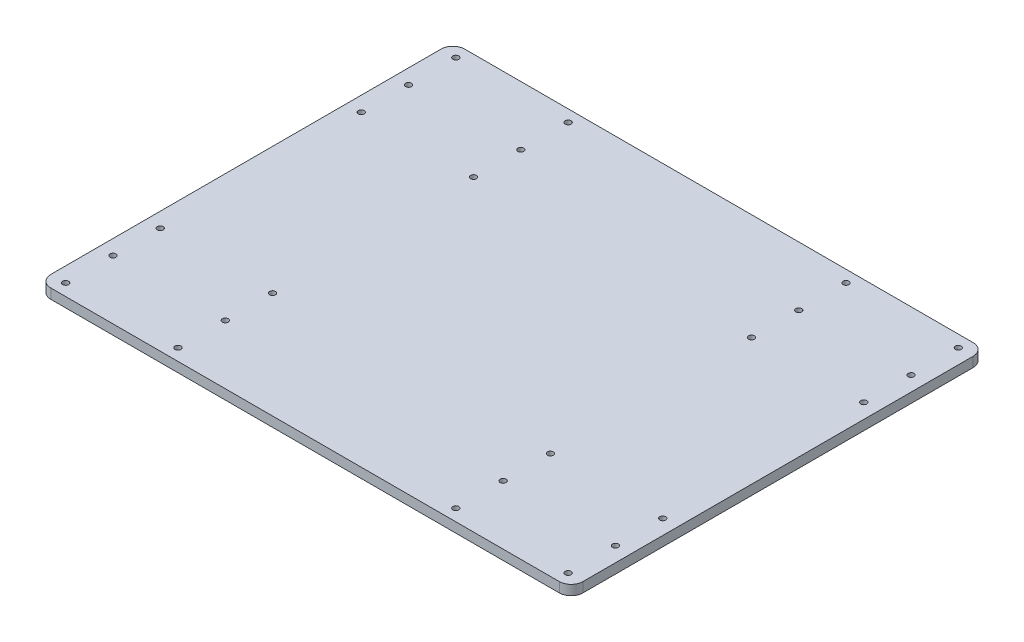
from build123d import *

# Parameters (mm, degrees)
SKETCH1_R           = 1.5
BOSS_EXTRUDE1_DEPTH = 5


with BuildPart() as part:
    # Sketch1 → Boss-Extrude1 (new body)
    with BuildSketch(Plane(origin=(0, 0, 0), x_dir=(1, 0, 0), z_dir=(0, 1, 0))):
        with BuildLine():
            Line((-129, -105), (129, -105))
            ThreePointArc((129, -105), (133.242640687, -103.242640687), (135, -99))
            Line((135, -99), (135, 99))
            ThreePointArc((135, 99), (133.242640687, 103.242640687), (129, 105))
            Line((129, 105), (-129, 105))
            ThreePointArc((-129, 105), (-133.242640687, 103.242640687), (-135, 99))
            Line((-135, 99), (-135, -99))
            ThreePointArc((-135, -99), (-133.242640687, -103.242640687), (-129, -105))
        make_face()
        with Locations(Location((-127.5, 99, 0), (0, 0, 270))):
            Circle(SKETCH1_R, mode=Mode.SUBTRACT)
        with Locations(Location((-127.5, 75, 0), (0, 0, 270))):
            Circle(SKETCH1_R, mode=Mode.SUBTRACT)
        with Locations(Location((-127.5, 51, 0), (0, 0, 270))):
            Circle(SKETCH1_R, mode=Mode.SUBTRACT)
        with Locations(Location((-70.5, 99, 0), (0, 0, 270))):
            Circle(SKETCH1_R, mode=Mode.SUBTRACT)
        with Locations(Location((-70.5, 75, 0), (0, 0, 270))):
            Circle(SKETCH1_R, mode=Mode.SUBTRACT)
        with Locations(Location((-70.5, 51, 0), (0, 0, 270))):
            Circle(SKETCH1_R, mode=Mode.SUBTRACT)
        with Locations(Location((70.5, 51, 0), (0, 0, 90))):
            Circle(SKETCH1_R, mode=Mode.SUBTRACT)
        with Locations(Location((70.5, 75, 0), (0, 0, 90))):
            Circle(SKETCH1_R, mode=Mode.SUBTRACT)
        with Locations(Location((70.5, 99, 0), (0, 0, 90))):
            Circle(SKETCH1_R, mode=Mode.SUBTRACT)
        with Locations(Location((127.5, 51, 0), (0, 0, 90))):
            Circle(SKETCH1_R, mode=Mode.SUBTRACT)
        with Locations(Location((127.5, 75, 0), (0, 0, 90))):
            Circle(SKETCH1_R, mode=Mode.SUBTRACT)
        with Locations(Location((127.5, 99, 0), (0, 0, 90))):
            Circle(SKETCH1_R, mode=Mode.SUBTRACT)
        with Locations(Location((127.5, -99, 0), (0, 0, 270))):
            Circle(SKETCH1_R, mode=Mode.SUBTRACT)
        with Locations(Location((127.5, -75, 0), (0, 0, 270))):
            Circle(SKETCH1_R, mode=Mode.SUBTRACT)
        with Locations(Location((127.5, -51, 0), (0, 0, 270))):
            Circle(SKETCH1_R, mode=Mode.SUBTRACT)
        with Locations(Location((70.5, -99, 0), (0, 0, 270))):
            Circle(SKETCH1_R, mode=Mode.SUBTRACT)
        with Locations(Location((70.5, -75, 0), (0, 0, 270))):
            Circle(SKETCH1_R, mode=Mode.SUBTRACT)
        with Locations(Location((70.5, -51, 0), (0, 0, 270))):
            Circle(SKETCH1_R, mode=Mode.SUBTRACT)
        with Locations(Location((-70.5, -51, 0), (0, 0, 90))):
            Circle(SKETCH1_R, mode=Mode.SUBTRACT)
        with Locations(Location((-70.5, -75, 0), (0, 0, 90))):
            Circle(SKETCH1_R, mode=Mode.SUBTRACT)
        with Locations(Location((-70.5, -99, 0), (0, 0, 90))):
            Circle(SKETCH1_R, mode=Mode.SUBTRACT)
        with Locations(Location((-127.5, -51, 0), (0, 0, 90))):
            Circle(SKETCH1_R, mode=Mode.SUBTRACT)
        with Locations(Location((-127.5, -75, 0), (0, 0, 90))):
            Circle(SKETCH1_R, mode=Mode.SUBTRACT)
        with Locations(Location((-127.5, -99, 0), (0, 0, 90))):
            Circle(SKETCH1_R, mode=Mode.SUBTRACT)
    extrude(amount=BOSS_EXTRUDE1_DEPTH)


solid = part.part
